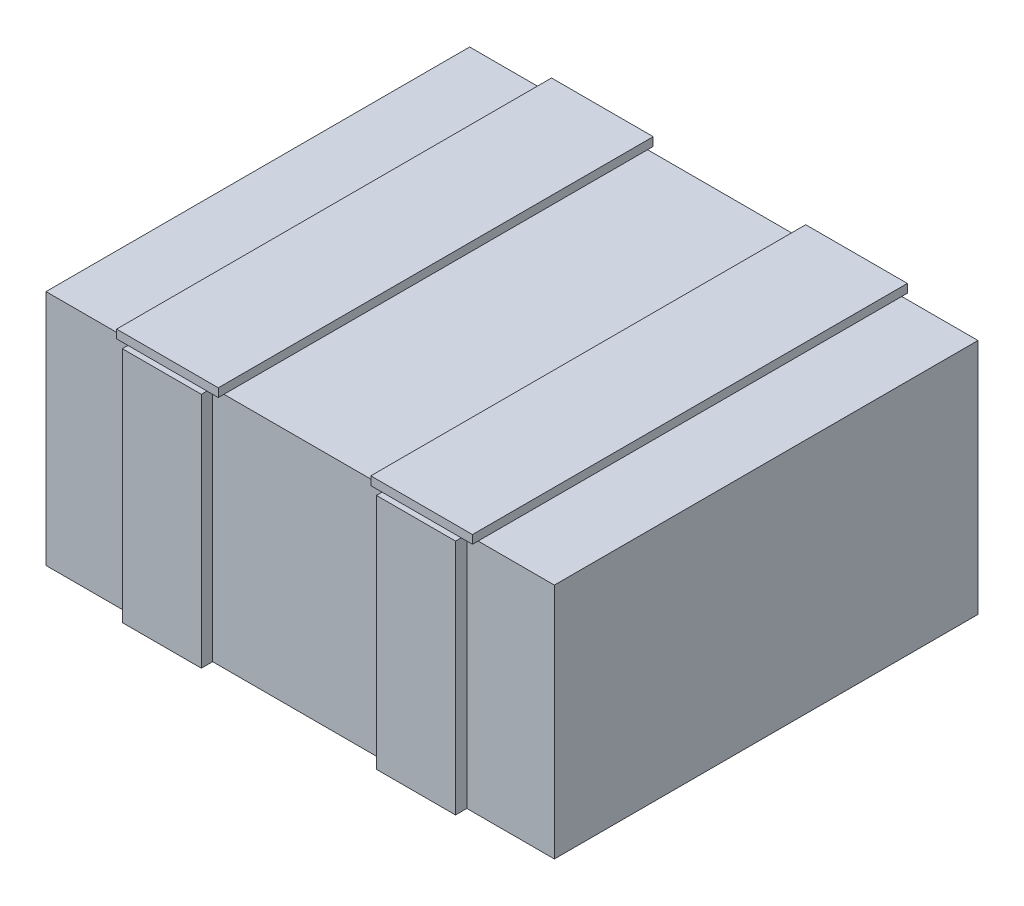
from build123d import *

# Parameters (mm, degrees)
SK_P01_PACK_W   = 90
SK_P01_PACK_H   = 75
P01_PACK_DEPTH  = 42
P02_STRAP_START = 42
SK_P02_STRAP_W  = 18
SK_P02_STRAP_H  = 77
P02_STRAP_DEPTH = 1.5
P03_STRAP_START = 42
SK_P03_STRAP_W  = 18
SK_P03_STRAP_H  = 77
P03_STRAP_DEPTH = 1.5
SK_P04_STRAP_W  = 14
SK_P04_STRAP_H  = 2
P04_STRAP_DEPTH = 42
SK_P05_STRAP_W  = 14
SK_P05_STRAP_H  = 2
P05_STRAP_DEPTH = 42
SK_P06_STRAP_W  = 14
SK_P06_STRAP_H  = 2
P06_STRAP_DEPTH = 42
SK_P07_STRAP_W  = 14
SK_P07_STRAP_H  = 2
P07_STRAP_DEPTH = 42


with BuildPart() as part:
    # SK_P01_Pack → P01_Pack (new body)
    with BuildSketch(Plane(origin=(0, 0, 0), x_dir=(1, 0, 0), z_dir=(0, 1, 0))):
        Rectangle(SK_P01_PACK_W, SK_P01_PACK_H)
    extrude(amount=P01_PACK_DEPTH)

    # SK_P02_Strap → P02_Strap (add)
    with BuildSketch(Plane(origin=(0, 0, 0), x_dir=(1, 0, 0), z_dir=(0, 1, 0)).offset(P02_STRAP_START)):
        with Locations((-22.5, 0)):
            Rectangle(SK_P02_STRAP_W, SK_P02_STRAP_H)
    extrude(amount=P02_STRAP_DEPTH)

    # SK_P03_Strap → P03_Strap (add)
    with BuildSketch(Plane(origin=(0, 0, 0), x_dir=(1, 0, 0), z_dir=(0, 1, 0)).offset(P03_STRAP_START)):
        with Locations((22.5, 0)):
            Rectangle(SK_P03_STRAP_W, SK_P03_STRAP_H)
    extrude(amount=P03_STRAP_DEPTH)

    # SK_P04_Strap → P04_Strap (add)
    with BuildSketch(Plane(origin=(0, 0, 0), x_dir=(1, 0, 0), z_dir=(0, 1, 0))):
        with Locations((-22.5, 38.5)):
            Rectangle(SK_P04_STRAP_W, SK_P04_STRAP_H)
    extrude(amount=P04_STRAP_DEPTH)

    # SK_P05_Strap → P05_Strap (add)
    with BuildSketch(Plane(origin=(0, 0, 0), x_dir=(1, 0, 0), z_dir=(0, 1, 0))):
        with Locations((-22.5, -38.5)):
            Rectangle(SK_P05_STRAP_W, SK_P05_STRAP_H)
    extrude(amount=P05_STRAP_DEPTH)

    # SK_P06_Strap → P06_Strap (add)
    with BuildSketch(Plane(origin=(0, 0, 0), x_dir=(1, 0, 0), z_dir=(0, 1, 0))):
        with Locations((22.5, 38.5)):
            Rectangle(SK_P06_STRAP_W, SK_P06_STRAP_H)
    extrude(amount=P06_STRAP_DEPTH)

    # SK_P07_Strap → P07_Strap (add)
    with BuildSketch(Plane(origin=(0, 0, 0), x_dir=(1, 0, 0), z_dir=(0, 1, 0))):
        with Locations((22.5, -38.5)):
            Rectangle(SK_P07_STRAP_W, SK_P07_STRAP_H)
    extrude(amount=P07_STRAP_DEPTH)


solid = part.part
